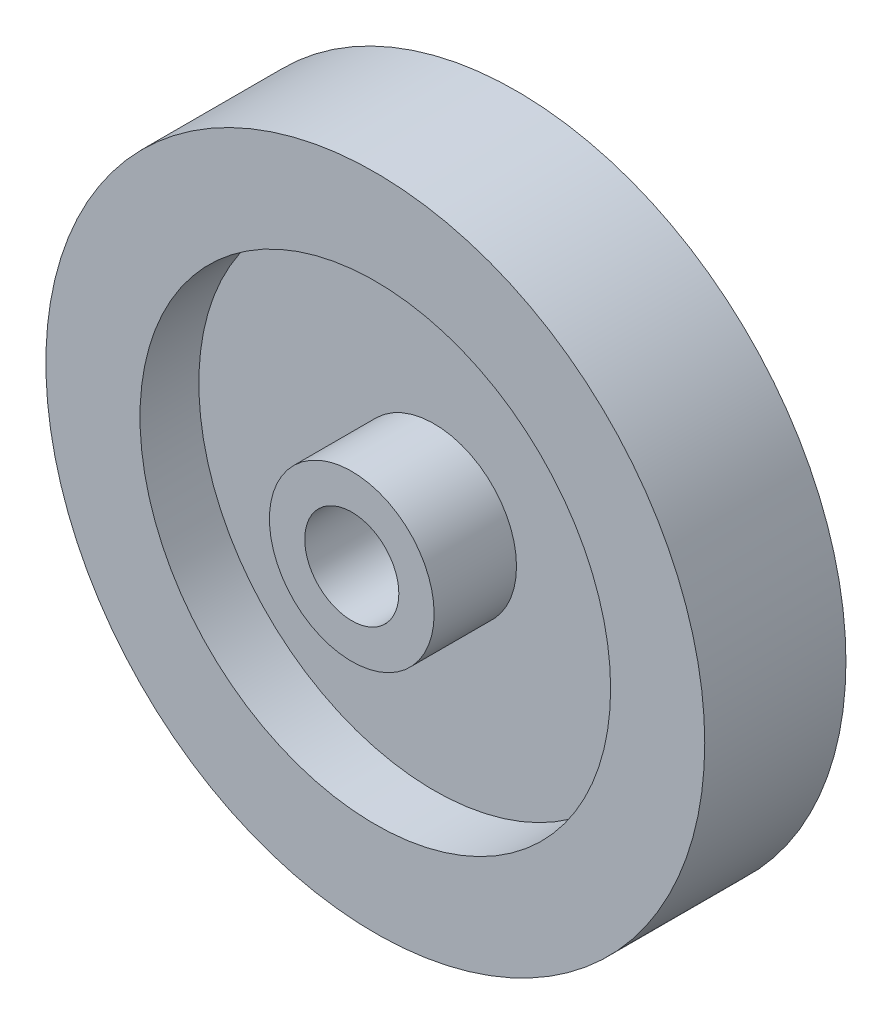
from build123d import *


with BuildPart() as part:
    # Sketch1 → Revolve2 (revolve)
    with BuildSketch(Plane(origin=(0, 0, 0), x_dir=(0, 0, -1), z_dir=(1, 0, 0)), mode=Mode.PRIVATE) as revolve2_sk:
        Polygon((-25.4, 12.7), (25.4, 12.7), (25.4, 22.225), (3.175, 22.225), (3.175, 63.5), (19.05, 63.5), (19.05, 88.9), (-19.05, 88.9), (-19.05, 63.5), (-3.175, 63.5), (-3.175, 22.225), (-25.4, 22.225), align=None)
    revolve(revolve2_sk.sketch.rotate(Axis((0, 0, 0), (0, 0, -1)), 90), axis=Axis((0, 0, 0), (0, 0, -1)))

    # Sketch2 → Cut-Revolve1 (revolve, cut)
    with BuildSketch(Plane(origin=(0, 0, 0), x_dir=(0, 0, -1), z_dir=(1, 0, 0)), mode=Mode.PRIVATE) as cut_revolve1_sk:
        Polygon((-10.972421975, 88.687029024), (-6.35, 75.987029024), (6.35, 75.987029024), (10.972421975, 88.687029024), align=None)
    revolve(cut_revolve1_sk.sketch.rotate(Axis((0, 0, 0), (0, 0, -1)), 90), axis=Axis((0, 0, 0), (0, 0, -1)), mode=Mode.SUBTRACT)


solid = part.part
